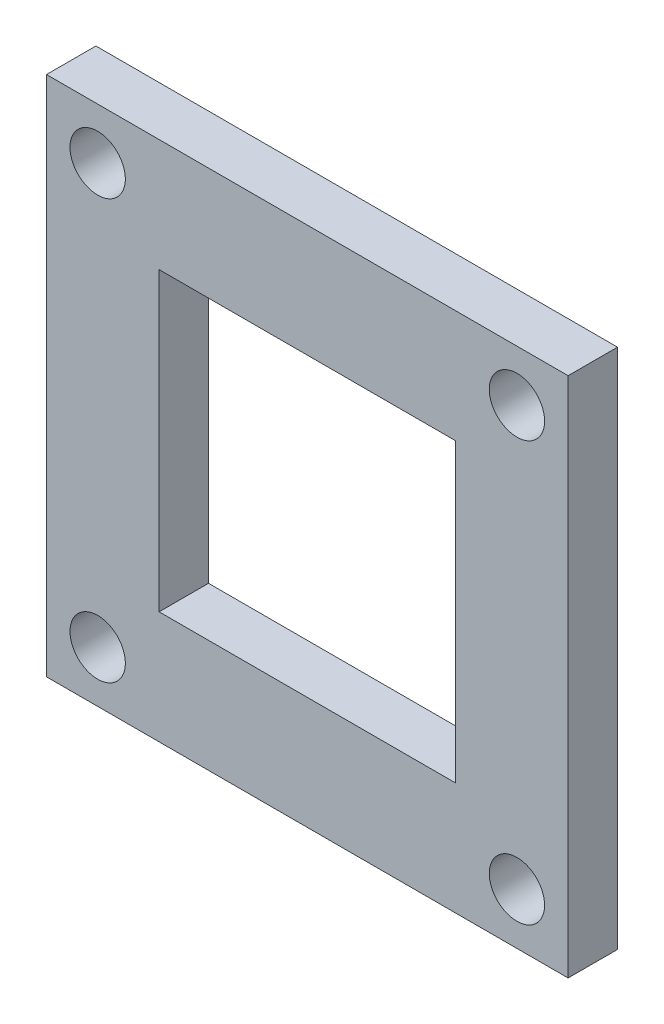
from build123d import *

# Parameters (mm, degrees)
SKETCH1_W           = 33.528
SKETCH1_H           = 33.528
BOSS_EXTRUDE1_DEPTH = 3.175
SKETCH2_W           = 19.05
SKETCH2_H           = 19.05
CUT_EXTRUDE1_DEPTH  = 3.175
SKETCH3_R           = 1.778
CUT_EXTRUDE2_DEPTH  = 3.175


with BuildPart() as part:
    # Sketch1 → Boss-Extrude1 (new body)
    with BuildSketch(Plane.XY):
        with Locations((16.764, 16.764)):
            Rectangle(SKETCH1_W, SKETCH1_H)
    extrude(amount=BOSS_EXTRUDE1_DEPTH)

    # Sketch2 → Cut-Extrude1 (cut)
    with BuildSketch(Plane.XY.offset(3.175)):
        with Locations((16.764, 16.764)):
            Rectangle(SKETCH2_W, SKETCH2_H)
    extrude(amount=-CUT_EXTRUDE1_DEPTH, mode=Mode.SUBTRACT)

    # Sketch3 → Cut-Extrude2 (cut)
    with BuildSketch(Plane.XY.offset(3.175)):
        with Locations((30.2387, 30.2387)):
            Circle(SKETCH3_R)
        with Locations((30.2387, 3.2893)):
            Circle(SKETCH3_R)
        with Locations(Location((3.2893, 3.2893, 0), (0, 0, 180))):
            Circle(SKETCH3_R)
        with Locations(Location((3.2893, 30.2387, 0), (0, 0, 180))):
            Circle(SKETCH3_R)
    extrude(amount=-CUT_EXTRUDE2_DEPTH, mode=Mode.SUBTRACT)


solid = part.part
